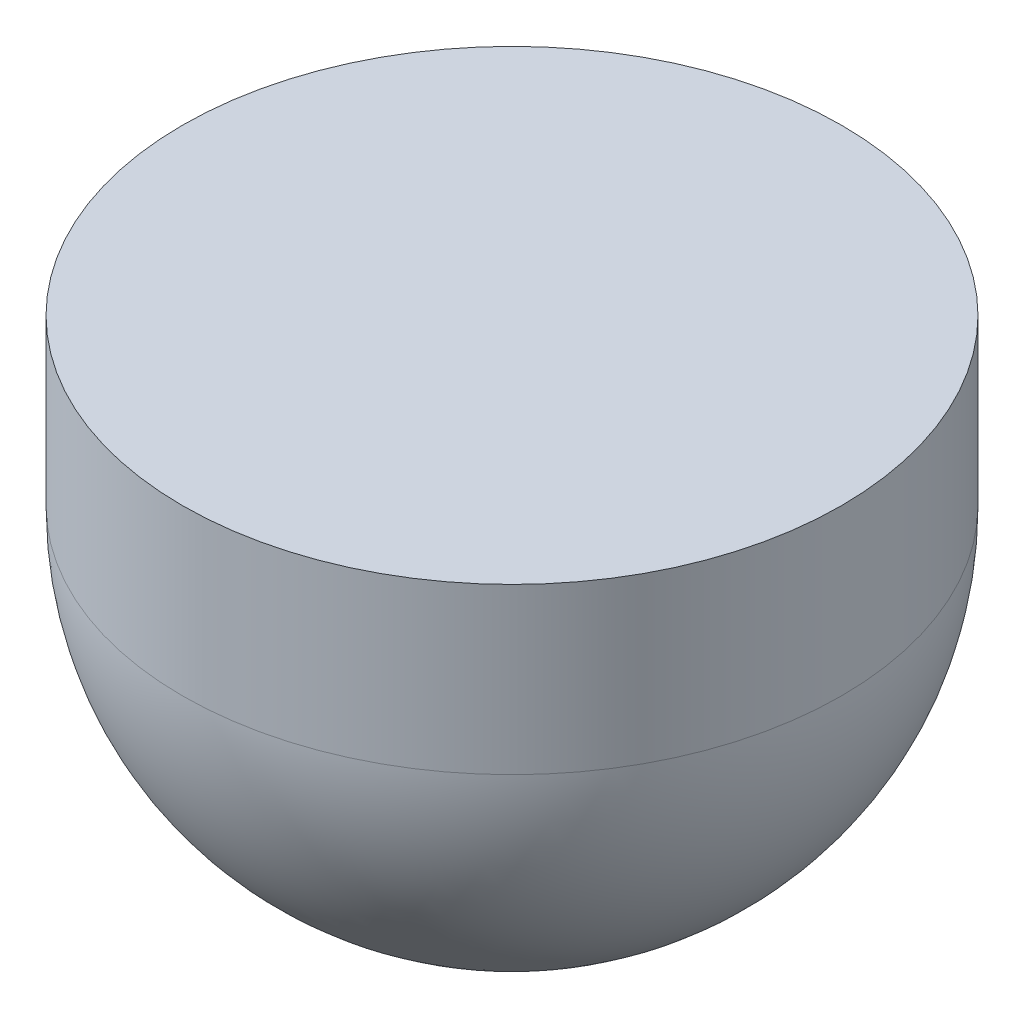
from build123d import *


with BuildPart() as part:
    # Sketch1 → Revolve1 (revolve)
    with BuildSketch(Plane.XY, mode=Mode.PRIVATE) as revolve1_sk:
        with BuildLine():
            Line((0, 0), (0, -16.801399594))
            Line((0, -16.801399594), (0, -30))
            ThreePointArc((0, -30), (-14.142135624, -24.142135624), (-20, -10))
            Line((-20, -10), (-20, 0))
            Line((-20, 0), (0, 0))
        make_face()
    revolve(revolve1_sk.sketch.rotate(Axis((0, 0, 0), (0, -1, 0)), 270), axis=Axis((0, 0, 0), (0, -1, 0)))


solid = part.part
